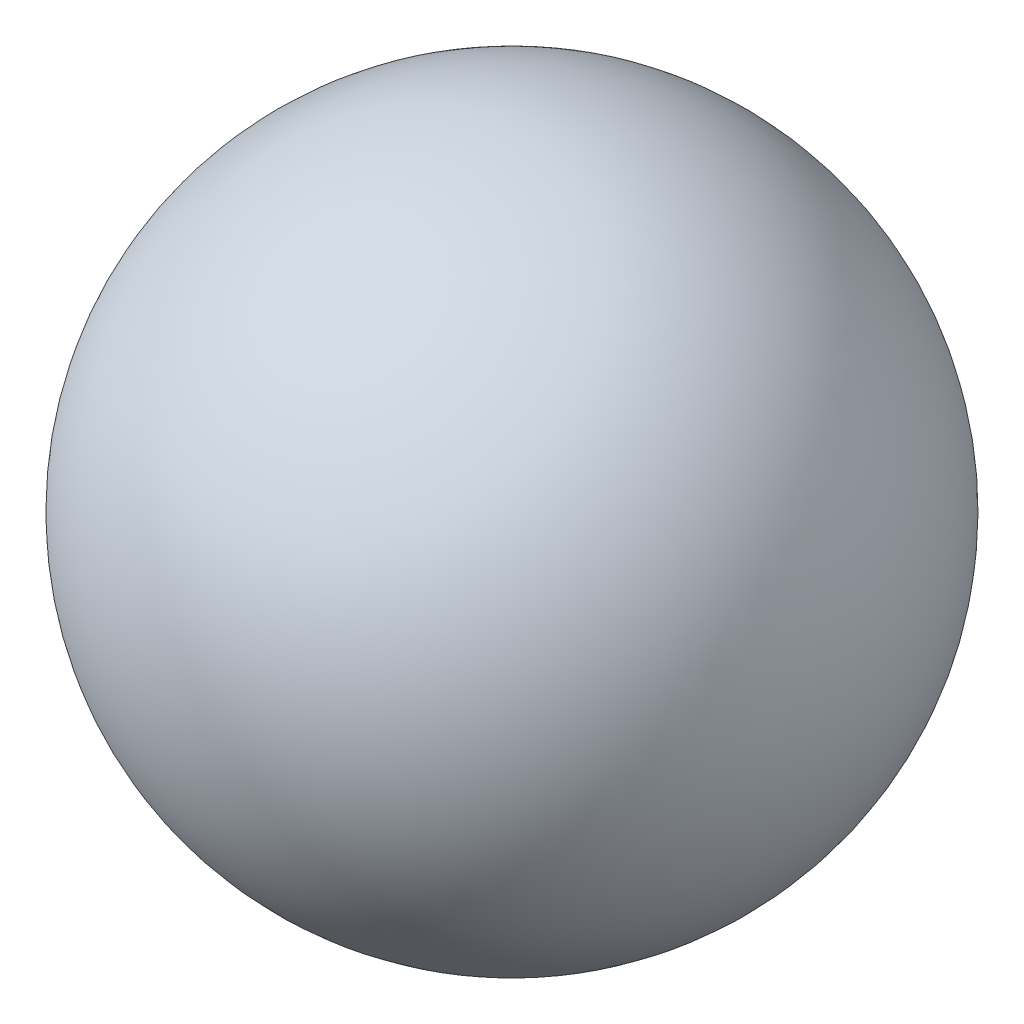
from build123d import *

# Parameters (mm, degrees)
SKETCH_2_W          = 12
SKETCH_2_H          = 3
CUT_EXTRUDE_1_DEPTH = 6
SKETCH_3_R          = 3
CUT_EXTRUDE_2_DEPTH = 15


with BuildPart() as part:
    # Эскиз1 → Revolve 273 (revolve)
    with BuildSketch(Plane.XY):
        with BuildLine():
            Line((0, 10), (0, 0))
            Line((0, 0), (0, -10))
            ThreePointArc((0, -10), (10, 0), (0, 10))
        make_face()
    revolve(axis=Axis((0, 10, 0), (0, -1, 0)))

    # Эскиз2 → Вырез-Вытянуть1 (cut, symmetric)
    with BuildSketch(Plane.XY):
        with Locations((0, -10)):
            Rectangle(SKETCH_2_W, SKETCH_2_H)
    extrude(amount=CUT_EXTRUDE_1_DEPTH, both=True, mode=Mode.SUBTRACT)

    # Эскиз3 → Вырез-Вытянуть2 (cut)
    with BuildSketch(Plane.XZ.offset(8.5)):
        with Locations(Location((0, 0, 0), (0, 0, 270))):
            Circle(SKETCH_3_R)
    extrude(amount=-CUT_EXTRUDE_2_DEPTH, mode=Mode.SUBTRACT)


solid = part.part
